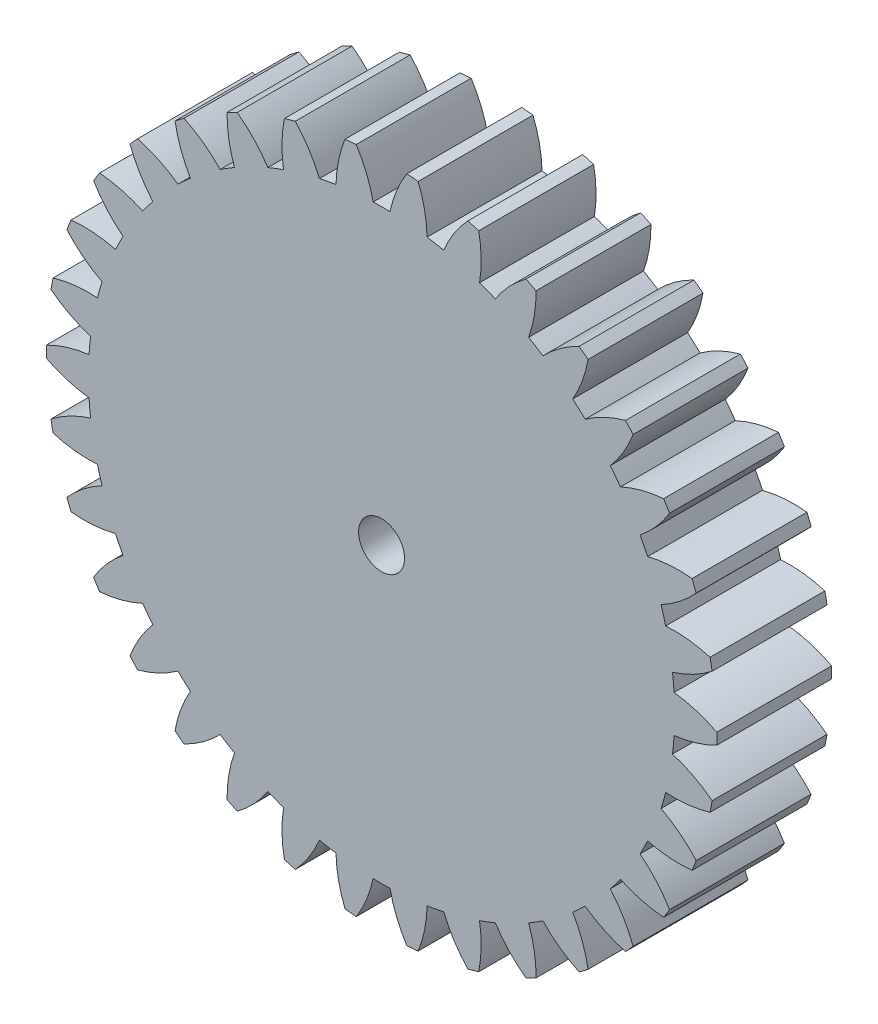
from build123d import *

# Parameters (mm, degrees)
SKETCH1_R           = 2.4
BOSS_EXTRUDE1_DEPTH = 5
BOSS_EXTRUDE2_START = -2
SKETCH4_R           = 2.4
SKETCH4_R_2         = 1
BOSS_EXTRUDE2_DEPTH = 2


with BuildPart() as part:
    # Sketch1 → Boss-Extrude1 (new body)
    with BuildSketch(Plane.XY):
        with BuildLine():
            ThreePointArc((-14.589407104, -0.246499776), (-13.684981484, -0.611693645), (-12.730348902, -0.811765875))
            ThreePointArc((-12.730348902, -0.811765875), (-12.701788537, -1.17699404), (-12.662752108, -1.541251454))
            ThreePointArc((-12.662752108, -1.541251454), (-13.564367081, -1.91333035), (-14.386288939, -2.438493871))
            ThreePointArc((-14.386288939, -2.438493871), (-14.343041527, -2.681179134), (-14.295700509, -2.92309917))
            ThreePointArc((-14.295700509, -2.92309917), (-13.339570256, -3.115887148), (-12.364428932, -3.137139491))
            ThreePointArc((-12.364428932, -3.137139491), (-12.269244362, -3.490900998), (-12.163940479, -3.841783313))
            ThreePointArc((-12.163940479, -3.841783313), (-12.981834426, -4.373198176), (-13.693262958, -5.040447535))
            ThreePointArc((-13.693262958, -5.040447535), (-13.606158615, -5.271053929), (-13.515170978, -5.500155927))
            ThreePointArc((-13.515170978, -5.500155927), (-12.539895962, -5.51397285), (-11.577453164, -5.355681584))
            ThreePointArc((-11.577453164, -5.355681584), (-11.418885786, -5.685929511), (-11.250900446, -6.011487849))
            ThreePointArc((-11.250900446, -6.011487849), (-11.957220969, -6.684141982), (-12.533929331, -7.470754803))
            ThreePointArc((-12.533929331, -7.470754803), (-12.405934291, -7.681429304), (-12.27439851, -7.889911471))
            ThreePointArc((-12.27439851, -7.889911471), (-11.313190551, -7.724286821), (-10.396221115, -7.391842364))
            ThreePointArc((-10.396221115, -7.391842364), (-10.17967075, -7.687330513), (-9.954724492, -7.976478377))
            ThreePointArc((-9.954724492, -7.976478377), (-10.525418693, -8.767465351), (-10.947767773, -9.646654477))
            ThreePointArc((-10.947767773, -9.646654477), (-10.783240754, -9.830222817), (-10.615636121, -10.010985542))
            ThreePointArc((-10.615636121, -10.010985542), (-9.701228005, -9.671559468), (-8.860958224, -9.176282818))
            ThreePointArc((-8.860958224, -9.176282818), (-8.593799236, -9.426948695), (-8.319552334, -9.6698395))
            ThreePointArc((-8.319552334, -9.6698395), (-8.735185907, -10.552223202), (-8.988793113, -11.494048902))
            ThreePointArc((-8.988793113, -11.494048902), (-8.793336886, -11.644259882), (-8.595370977, -11.791147508))
            ThreePointArc((-8.595370977, -11.791147508), (-7.758901774, -11.289478757), (-7.023946029, -10.648235966))
            ThreePointArc((-7.023946029, -10.648235966), (-6.715276196, -10.845543445), (-6.401067801, -11.033905837))
            ThreePointArc((-6.401067801, -11.033905837), (-6.647486843, -11.977637748), (-6.723715886, -12.950027277))
            ThreePointArc((-6.723715886, -12.950027277), (-6.503986476, -13.061765643), (-6.282400783, -13.169776087))
            ThreePointArc((-6.282400783, -13.169776087), (-5.552355449, -12.522948387), (-4.947741775, -11.75757621))
            ThreePointArc((-4.947741775, -11.75757621), (-4.608072479, -11.894806221), (-4.26460258, -12.022225744))
            ThreePointArc((-4.26460258, -12.022225744), (-4.333415586, -12.995168206), (-4.229670578, -13.965008006))
            ThreePointArc((-4.229670578, -13.965008006), (-3.993150608, -14.03446864), (-3.755490965, -14.099923737))
            ThreePointArc((-3.755490965, -14.099923737), (-3.156730318, -13.32996403), (-2.70304811, -12.466526297))
            ThreePointArc((-2.70304811, -12.466526297), (-2.343946381, -12.539005637), (-1.982911434, -12.601143172))
            ThreePointArc((-1.982911434, -12.601143172), (-1.871775059, -13.570163797), (-1.591588911, -14.504427136))
            ThreePointArc((-1.591588911, -14.504427136), (-1.346332786, -14.52924464), (-1.100692407, -14.549915396))
            ThreePointArc((-1.100692407, -14.549915396), (-0.653606523, -13.683043735), (-0.366305384, -12.750943783))
            ThreePointArc((-0.366305384, -12.750943783), (0, -12.756204255), (0.366305384, -12.750943783))
            ThreePointArc((0.366305384, -12.750943783), (0.653606523, -13.683043735), (1.100692407, -14.549915396))
            ThreePointArc((1.100692407, -14.549915396), (1.346332786, -14.52924464), (1.591588911, -14.504427136))
            ThreePointArc((1.591588911, -14.504427136), (1.871775059, -13.570163797), (1.982911434, -12.601143172))
            ThreePointArc((1.982911434, -12.601143172), (2.343946381, -12.539005637), (2.70304811, -12.466526297))
            ThreePointArc((2.70304811, -12.466526297), (3.156730318, -13.32996403), (3.755490965, -14.099923737))
            ThreePointArc((3.755490965, -14.099923737), (3.993150608, -14.03446864), (4.229670578, -13.965008006))
            ThreePointArc((4.229670578, -13.965008006), (4.333415586, -12.995168206), (4.26460258, -12.022225744))
            ThreePointArc((4.26460258, -12.022225744), (4.608072479, -11.894806221), (4.947741775, -11.75757621))
            ThreePointArc((4.947741775, -11.75757621), (5.552355449, -12.522948387), (6.282400783, -13.169776087))
            ThreePointArc((6.282400783, -13.169776087), (6.503986476, -13.061765643), (6.723715886, -12.950027277))
            ThreePointArc((6.723715886, -12.950027277), (6.647486843, -11.977637748), (6.401067801, -11.033905837))
            ThreePointArc((6.401067801, -11.033905837), (6.715276196, -10.845543445), (7.023946029, -10.648235966))
            ThreePointArc((7.023946029, -10.648235966), (7.758901774, -11.289478757), (8.595370977, -11.791147508))
            ThreePointArc((8.595370977, -11.791147508), (8.793336886, -11.644259882), (8.988793113, -11.494048902))
            ThreePointArc((8.988793113, -11.494048902), (8.735185907, -10.552223202), (8.319552334, -9.6698395))
            ThreePointArc((8.319552334, -9.6698395), (8.593799236, -9.426948695), (8.860958224, -9.176282818))
            ThreePointArc((8.860958224, -9.176282818), (9.701228005, -9.671559468), (10.615636121, -10.010985542))
            ThreePointArc((10.615636121, -10.010985542), (10.783240754, -9.830222817), (10.947767773, -9.646654477))
            ThreePointArc((10.947767773, -9.646654477), (10.525418693, -8.767465351), (9.954724492, -7.976478377))
            ThreePointArc((9.954724492, -7.976478377), (10.17967075, -7.687330513), (10.396221115, -7.391842364))
            ThreePointArc((10.396221115, -7.391842364), (11.313190551, -7.724286821), (12.27439851, -7.889911471))
            ThreePointArc((12.27439851, -7.889911471), (12.405934291, -7.681429304), (12.533929331, -7.470754803))
            ThreePointArc((12.533929331, -7.470754803), (11.957220969, -6.684141982), (11.250900446, -6.011487849))
            ThreePointArc((11.250900446, -6.011487849), (11.418885786, -5.685929511), (11.577453164, -5.355681584))
            ThreePointArc((11.577453164, -5.355681584), (12.539895962, -5.51397285), (13.515170978, -5.500155927))
            ThreePointArc((13.515170978, -5.500155927), (13.606158615, -5.271053929), (13.693262958, -5.040447535))
            ThreePointArc((13.693262958, -5.040447535), (12.981834426, -4.373198176), (12.163940479, -3.841783313))
            ThreePointArc((12.163940479, -3.841783313), (12.269244362, -3.490900998), (12.364428932, -3.137139491))
            ThreePointArc((12.364428932, -3.137139491), (13.339570256, -3.115887148), (14.295700509, -2.92309917))
            ThreePointArc((14.295700509, -2.92309917), (14.343041527, -2.681179134), (14.386288939, -2.438493871))
            ThreePointArc((14.386288939, -2.438493871), (13.564367081, -1.91333035), (12.662752108, -1.541251454))
            ThreePointArc((12.662752108, -1.541251454), (12.701788537, -1.17699404), (12.730348902, -0.811765875))
            ThreePointArc((12.730348902, -0.811765875), (13.684981484, -0.611693645), (14.589407104, -0.246499776))
            ThreePointArc((14.589407104, -0.246499776), (14.591489362, 0), (14.589407104, 0.246499776))
            ThreePointArc((14.589407104, 0.246499776), (13.684981484, 0.611693645), (12.730348902, 0.811765875))
            ThreePointArc((12.730348902, 0.811765875), (12.701788537, 1.17699404), (12.662752108, 1.541251454))
            ThreePointArc((12.662752108, 1.541251454), (13.564367081, 1.91333035), (14.386288939, 2.438493871))
            ThreePointArc((14.386288939, 2.438493871), (14.343041527, 2.681179134), (14.295700509, 2.92309917))
            ThreePointArc((14.295700509, 2.92309917), (13.339570256, 3.115887148), (12.364428932, 3.137139491))
            ThreePointArc((12.364428932, 3.137139491), (12.269244362, 3.490900998), (12.163940479, 3.841783313))
            ThreePointArc((12.163940479, 3.841783313), (12.981834426, 4.373198176), (13.693262958, 5.040447535))
            ThreePointArc((13.693262958, 5.040447535), (13.606158615, 5.271053929), (13.515170978, 5.500155927))
            ThreePointArc((13.515170978, 5.500155927), (12.539895962, 5.51397285), (11.577453164, 5.355681584))
            ThreePointArc((11.577453164, 5.355681584), (11.418885786, 5.685929511), (11.250900446, 6.011487849))
            ThreePointArc((11.250900446, 6.011487849), (11.957220969, 6.684141982), (12.533929331, 7.470754803))
            ThreePointArc((12.533929331, 7.470754803), (12.405934291, 7.681429304), (12.27439851, 7.889911471))
            ThreePointArc((12.27439851, 7.889911471), (11.313190551, 7.724286821), (10.396221115, 7.391842364))
            ThreePointArc((10.396221115, 7.391842364), (10.17967075, 7.687330513), (9.954724492, 7.976478377))
            ThreePointArc((9.954724492, 7.976478377), (10.525418693, 8.767465351), (10.947767773, 9.646654477))
            ThreePointArc((10.947767773, 9.646654477), (10.783240754, 9.830222817), (10.615636121, 10.010985542))
            ThreePointArc((10.615636121, 10.010985542), (9.701228005, 9.671559468), (8.860958224, 9.176282818))
            ThreePointArc((8.860958224, 9.176282818), (8.593799236, 9.426948695), (8.319552334, 9.6698395))
            ThreePointArc((8.319552334, 9.6698395), (8.735185907, 10.552223202), (8.988793113, 11.494048902))
            ThreePointArc((8.988793113, 11.494048902), (8.793336886, 11.644259882), (8.595370977, 11.791147508))
            ThreePointArc((8.595370977, 11.791147508), (7.758901774, 11.289478757), (7.023946029, 10.648235966))
            ThreePointArc((7.023946029, 10.648235966), (6.715276196, 10.845543445), (6.401067801, 11.033905837))
            ThreePointArc((6.401067801, 11.033905837), (6.647486843, 11.977637748), (6.723715886, 12.950027277))
            ThreePointArc((6.723715886, 12.950027277), (6.503986476, 13.061765643), (6.282400783, 13.169776087))
            ThreePointArc((6.282400783, 13.169776087), (5.552355449, 12.522948387), (4.947741775, 11.75757621))
            ThreePointArc((4.947741775, 11.75757621), (4.608072479, 11.894806221), (4.26460258, 12.022225744))
            ThreePointArc((4.26460258, 12.022225744), (4.333415586, 12.995168206), (4.229670578, 13.965008006))
            ThreePointArc((4.229670578, 13.965008006), (3.993150608, 14.03446864), (3.755490965, 14.099923737))
            ThreePointArc((3.755490965, 14.099923737), (3.156730318, 13.32996403), (2.70304811, 12.466526297))
            ThreePointArc((2.70304811, 12.466526297), (2.343946381, 12.539005637), (1.982911434, 12.601143172))
            ThreePointArc((1.982911434, 12.601143172), (1.871775059, 13.570163797), (1.591588911, 14.504427136))
            ThreePointArc((1.591588911, 14.504427136), (1.346332786, 14.52924464), (1.100692407, 14.549915396))
            ThreePointArc((1.100692407, 14.549915396), (0.653606523, 13.683043735), (0.366305384, 12.750943783))
            ThreePointArc((0.366305384, 12.750943783), (0, 12.756204255), (-0.366305384, 12.750943783))
            ThreePointArc((-0.366305384, 12.750943783), (-0.653606523, 13.683043735), (-1.100692407, 14.549915396))
            ThreePointArc((-1.100692407, 14.549915396), (-1.346332786, 14.52924464), (-1.591588911, 14.504427136))
            ThreePointArc((-1.591588911, 14.504427136), (-1.871775059, 13.570163797), (-1.982911434, 12.601143172))
            ThreePointArc((-1.982911434, 12.601143172), (-2.343946381, 12.539005637), (-2.70304811, 12.466526297))
            ThreePointArc((-2.70304811, 12.466526297), (-3.156730318, 13.32996403), (-3.755490965, 14.099923737))
            ThreePointArc((-3.755490965, 14.099923737), (-3.993150608, 14.03446864), (-4.229670578, 13.965008006))
            ThreePointArc((-4.229670578, 13.965008006), (-4.333415586, 12.995168206), (-4.26460258, 12.022225744))
            ThreePointArc((-4.26460258, 12.022225744), (-4.608072479, 11.894806221), (-4.947741775, 11.75757621))
            ThreePointArc((-4.947741775, 11.75757621), (-5.552355449, 12.522948387), (-6.282400783, 13.169776087))
            ThreePointArc((-6.282400783, 13.169776087), (-6.503986476, 13.061765643), (-6.723715886, 12.950027277))
            ThreePointArc((-6.723715886, 12.950027277), (-6.647486843, 11.977637748), (-6.401067801, 11.033905837))
            ThreePointArc((-6.401067801, 11.033905837), (-6.715276196, 10.845543445), (-7.023946029, 10.648235966))
            ThreePointArc((-7.023946029, 10.648235966), (-7.758901774, 11.289478757), (-8.595370977, 11.791147508))
            ThreePointArc((-8.595370977, 11.791147508), (-8.793336886, 11.644259882), (-8.988793113, 11.494048902))
            ThreePointArc((-8.988793113, 11.494048902), (-8.735185907, 10.552223202), (-8.319552334, 9.6698395))
            ThreePointArc((-8.319552334, 9.6698395), (-8.593799236, 9.426948695), (-8.860958224, 9.176282818))
            ThreePointArc((-8.860958224, 9.176282818), (-9.701228005, 9.671559468), (-10.615636121, 10.010985542))
            ThreePointArc((-10.615636121, 10.010985542), (-10.783240754, 9.830222817), (-10.947767773, 9.646654477))
            ThreePointArc((-10.947767773, 9.646654477), (-10.525418693, 8.767465351), (-9.954724492, 7.976478377))
            ThreePointArc((-9.954724492, 7.976478377), (-10.17967075, 7.687330513), (-10.396221115, 7.391842364))
            ThreePointArc((-10.396221115, 7.391842364), (-11.313190551, 7.724286821), (-12.27439851, 7.889911471))
            ThreePointArc((-12.27439851, 7.889911471), (-12.405934291, 7.681429304), (-12.533929331, 7.470754803))
            ThreePointArc((-12.533929331, 7.470754803), (-11.957220969, 6.684141982), (-11.250900446, 6.011487849))
            ThreePointArc((-11.250900446, 6.011487849), (-11.418885786, 5.685929511), (-11.577453164, 5.355681584))
            ThreePointArc((-11.577453164, 5.355681584), (-12.539895962, 5.51397285), (-13.515170978, 5.500155927))
            ThreePointArc((-13.515170978, 5.500155927), (-13.606158615, 5.271053929), (-13.693262958, 5.040447535))
            ThreePointArc((-13.693262958, 5.040447535), (-12.981834426, 4.373198176), (-12.163940479, 3.841783313))
            ThreePointArc((-12.163940479, 3.841783313), (-12.269244362, 3.490900998), (-12.364428932, 3.137139491))
            ThreePointArc((-12.364428932, 3.137139491), (-13.339570256, 3.115887148), (-14.295700509, 2.92309917))
            ThreePointArc((-14.295700509, 2.92309917), (-14.343041527, 2.681179134), (-14.386288939, 2.438493871))
            ThreePointArc((-14.386288939, 2.438493871), (-13.564367081, 1.91333035), (-12.662752108, 1.541251454))
            ThreePointArc((-12.662752108, 1.541251454), (-12.701788537, 1.17699404), (-12.730348902, 0.811765875))
            ThreePointArc((-12.730348902, 0.811765875), (-13.684981484, 0.611693645), (-14.589407104, 0.246499776))
            ThreePointArc((-14.589407104, 0.246499776), (-14.591489362, 0), (-14.589407104, -0.246499776))
        make_face()
        Circle(SKETCH1_R, mode=Mode.SUBTRACT)
    extrude(amount=BOSS_EXTRUDE1_DEPTH)

    # Sketch4 → Boss-Extrude2 (add)
    with BuildSketch(Plane.XY.offset(5).offset(BOSS_EXTRUDE2_START)):
        Circle(SKETCH4_R)
        Circle(SKETCH4_R_2, mode=Mode.SUBTRACT)
    extrude(amount=BOSS_EXTRUDE2_DEPTH)


solid = part.part
